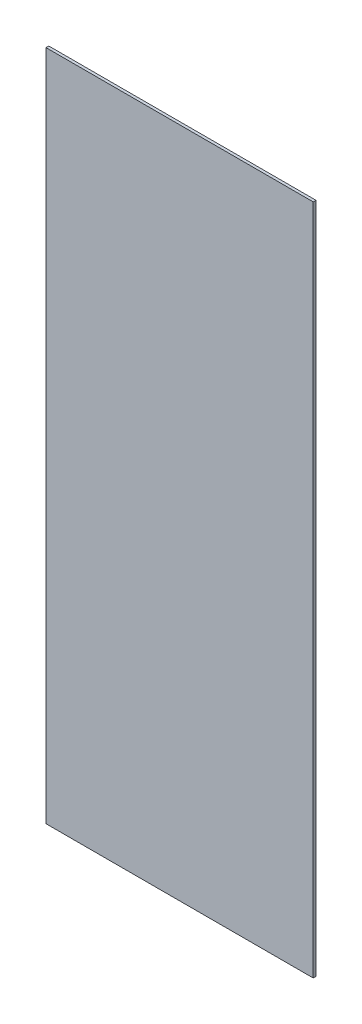
from build123d import *

# Parameters (mm, degrees)
SKETCH2_W           = 243.332
SKETCH2_H           = 612.14
BOSS_EXTRUDE1_DEPTH = 2.54


with BuildPart() as part:
    # Sketch2 → Boss-Extrude1 (new body)
    with BuildSketch(Plane.XY):
        with Locations((888.823776387, -775.83385267)):
            Rectangle(SKETCH2_W, SKETCH2_H)
    extrude(amount=BOSS_EXTRUDE1_DEPTH)


solid = part.part
